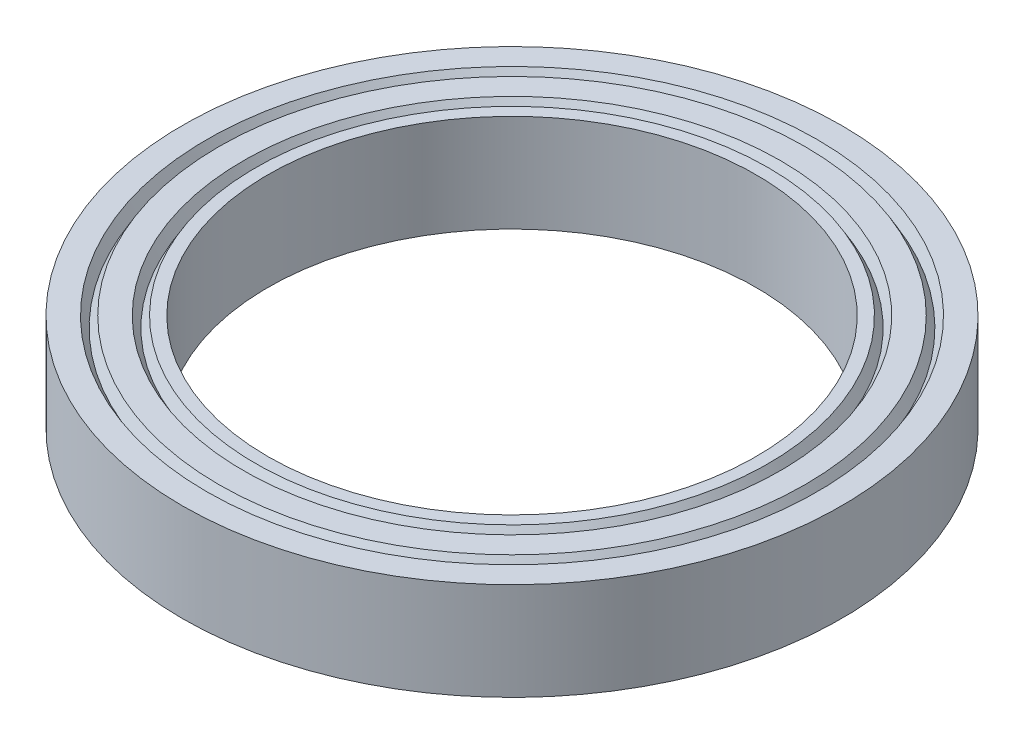
from build123d import *

# Parameters (mm, degrees)
SKETCH_1_R      = 13.5
SKETCH_1_R_2    = 10
EXTRUDE_1_DEPTH = 4


with BuildPart() as part:
    # 草图1 → 凸台-拉伸1 (new body)
    with BuildSketch(Plane(origin=(0, 0, 0), x_dir=(1, 0, 0), z_dir=(0, 1, 0))):
        with Locations(Location((0, 0, 0), (0, 0, 270))):
            Circle(SKETCH_1_R)
        with Locations(Location((0, 0, 0), (0, 0, 270))):
            Circle(SKETCH_1_R_2, mode=Mode.SUBTRACT)
    extrude(amount=EXTRUDE_1_DEPTH)

    # 草图3 → 切除-旋转1 (revolve, cut)
    with BuildSketch(Plane.XY, mode=Mode.PRIVATE) as cut_revolve_1_sk:
        Polygon((-12.25, 3.566987298), (-12, 4), (-12.5, 4), align=None)
        Polygon((-10.75, 3.566987298), (-10.5, 4), (-11, 4), align=None)
    cut_revolve_1 = revolve(cut_revolve_1_sk.sketch.rotate(Axis((0, 4, 0), (0, 1, 0)), 270), axis=Axis((0, 4, 0), (0, 1, 0)), mode=Mode.SUBTRACT)

    # 镜向1: 切除-旋转1 across plane
    add(cut_revolve_1.mirror(Plane.ZX.offset(2)), mode=Mode.SUBTRACT)


solid = part.part
